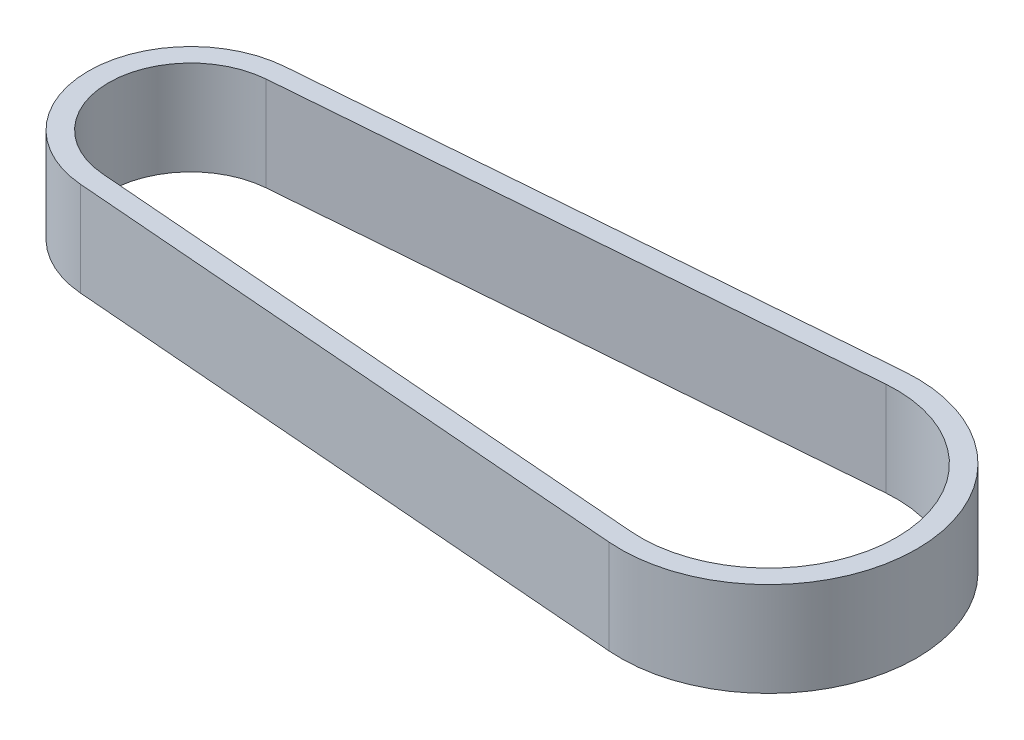
from build123d import *

# Parameters (mm, degrees)
BOSS_EXTRUDE1_DEPTH = 7


with BuildPart() as part:
    # Sketch1 → Boss-Extrude1 (new body)
    with BuildSketch(Plane(origin=(0, 0, 0), x_dir=(1, 0, 0), z_dir=(0, 1, 0))):
        with BuildLine():
            Line((-0.602331002, 7.576093806), (42.028205128, 10.96539893))
            ThreePointArc((42.028205128, 10.96539893), (53.9, 0), (42.028205128, -10.96539893))
            Line((42.028205128, -10.96539893), (-0.602331002, -7.576093806))
            ThreePointArc((-0.602331002, -7.576093806), (-7.6, 0), (-0.602331002, 7.576093806))
        make_face()
        with BuildLine():
            Line((-0.483449883, 6.080812134), (42.147086247, 9.470117258))
            ThreePointArc((42.147086247, 9.470117258), (52.4, 0), (42.147086247, -9.470117258))
            Line((42.147086247, -9.470117258), (-0.483449883, -6.080812134))
            ThreePointArc((-0.483449883, -6.080812134), (-6.1, 0), (-0.483449883, 6.080812134))
        make_face(mode=Mode.SUBTRACT)
    extrude(amount=BOSS_EXTRUDE1_DEPTH)


solid = part.part
